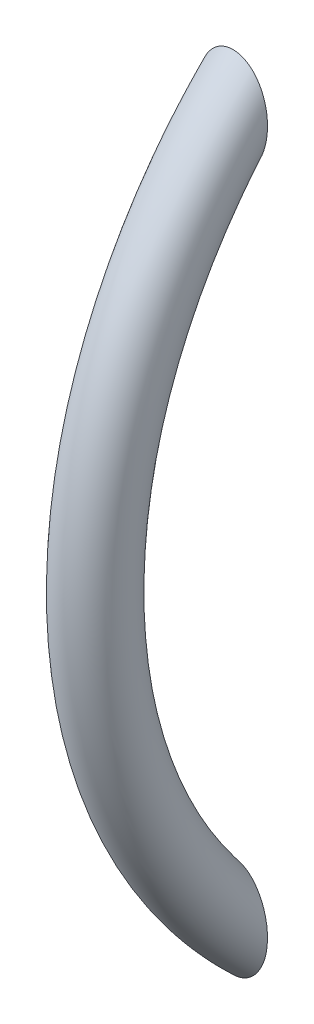
from build123d import *

# Parameters (mm, degrees)
SKETCH1_R               = 5
CUT_EXTRUDE1_DEPTH      = 187.102122647
CUT_EXTRUDE1_DEPTH_BACK = 187.102122647
SKETCH2_W               = 140
SKETCH2_H               = 170
SKETCH4_R               = 2.5
CUT_EXTRUDE2_DEPTH      = 5


with BuildPart() as part:
    # Sketch1 → Revolve1 (revolve)
    with BuildSketch(Plane.XZ.offset(48)):
        with Locations((0, 20)):
            Circle(SKETCH1_R)
    revolve(axis=Axis((-43.255842548, -48, -55), (1, 0, 0)))

    # Sketch2 → Cut-Extrude1 (cut, two sides: drawn at the far end of the back side and taken through both)
    with BuildSketch(Plane(origin=(0, 0, 0), x_dir=(0, 0, -1), z_dir=(1, 0, 0)).offset(-CUT_EXTRUDE1_DEPTH_BACK)):
        with Locations((70, -50)):
            Rectangle(SKETCH2_W, SKETCH2_H)
    extrude(amount=CUT_EXTRUDE1_DEPTH + CUT_EXTRUDE1_DEPTH_BACK, mode=Mode.SUBTRACT)

    # Sketch4 → Cut-Extrude2 (cut)
    with BuildSketch(Plane.XY):
        Circle(SKETCH4_R)
        with Locations((0, -96)):
            Circle(SKETCH4_R)
    extrude(amount=CUT_EXTRUDE2_DEPTH, mode=Mode.SUBTRACT)


solid = part.part
